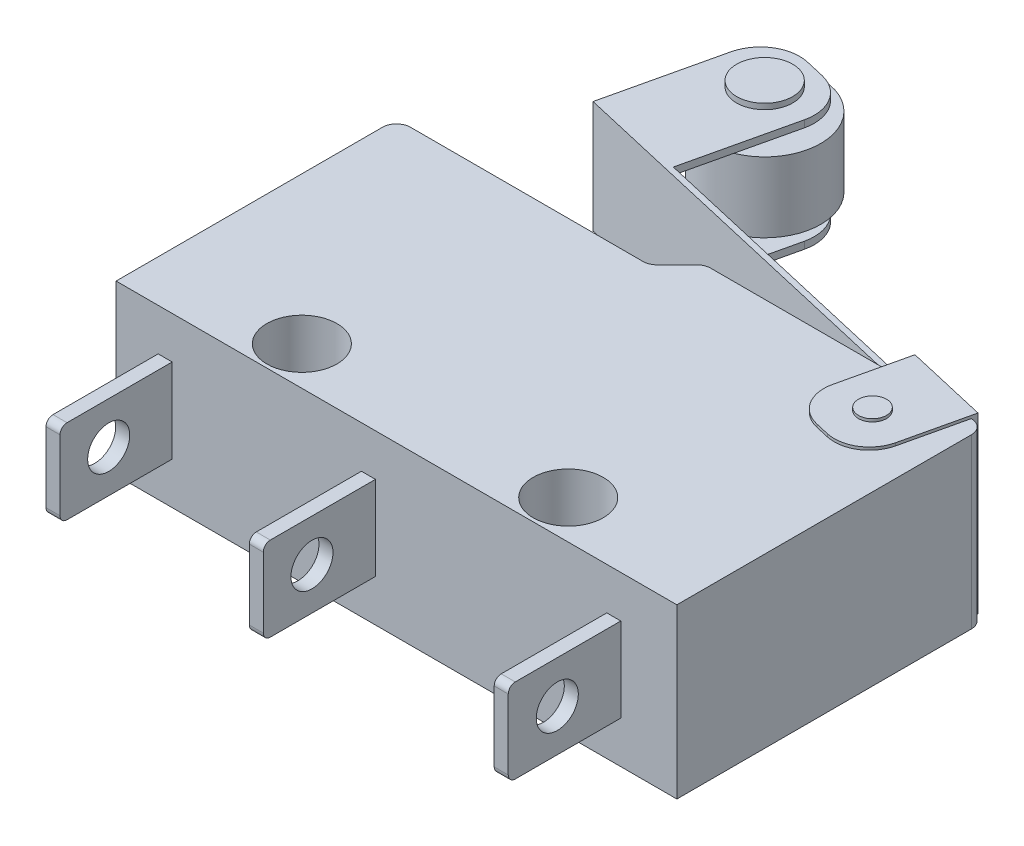
from build123d import *

# Parameters (mm, degrees)
Y_KSEKLIK_EKSTR_ZYON1_DEPTH       = 3
Y_KSEKLIK_EKSTR_ZYON1_DEPTH_BACK  = 3
IZIM1_R                           = 1.25
IZIM2_W                           = 2
IZIM2_H                           = 2
Y_KSEKLIK_EKSTR_ZYON2_DEPTH       = 1.5
Y_KSEKLIK_EKSTR_ZYON6_DEPTH       = 3.1
Y_KSEKLIK_EKSTR_ZYON6_DEPTH_BACK  = 3.1
KES_EKSTR_ZYON1_DEPTH             = 6
KES_EKSTR_ZYON1_DEPTH_BACK        = 0.5
IZIM5_W                           = 5
IZIM5_H                           = 3.50112481
KES_EKSTR_ZYON2_DEPTH             = 5.25
Y_KSEKLIK_EKSTR_ZYON7_DEPTH       = 1.25
Y_KSEKLIK_EKSTR_ZYON7_DEPTH_BACK  = 1.25
IZIM6_R                           = 2
Y_KSEKLIK_EKSTR_ZYON8_DEPTH       = 2.2
Y_KSEKLIK_EKSTR_ZYON8_DEPTH_BACK  = 2.2
IZIM7_R                           = 1
Y_KSEKLIK_EKSTR_ZYON9_DEPTH       = 0.25
Y_KSEKLIK_EKSTR_ZYON9_DEPTH_BACK  = 0.25
Y_KSEKLIK_EKSTR_ZYON10_DEPTH      = 0.25
Y_KSEKLIK_EKSTR_ZYON10_DEPTH_BACK = 0.25
Y_KSEKLIK_EKSTR_ZYON11_DEPTH      = 0.25
Y_KSEKLIK_EKSTR_ZYON11_DEPTH_BACK = 0.25
KES_EKSTR_ZYON3_REACH             = 25.675
IZIM11_R                          = 0.75
Y_KSEKLIK_EKSTR_ZYON13_DEPTH      = 3.2
Y_KSEKLIK_EKSTR_ZYON13_DEPTH_BACK = 3.2
IZIM13_R                          = 0.5


with BuildPart() as part:
    # Çizim1 → Yükseklik-Ekstrüzyon1 (new, two sides: drawn at the far end of the back side and taken through both)
    with BuildSketch(Plane(origin=(0, 0, 0), x_dir=(1, 0, 0), z_dir=(0, 1, 0)).offset(-Y_KSEKLIK_EKSTR_ZYON1_DEPTH_BACK)):
        with BuildLine():
            Line((0.207106781, 5.5), (9.5, 5.5))
            ThreePointArc((9.5, 5.5), (9.853553391, 5.353553391), (10, 5))
            Line((10, 5), (10, -5.5))
            Line((10, -5.5), (-10, -5.5))
            Line((-10, -5.5), (-10, 4))
            ThreePointArc((-10, 4), (-9.853553391, 4.353553391), (-9.5, 4.5))
            Line((-9.5, 4.5), (-1.207106781, 4.5))
            ThreePointArc((-1.207106781, 4.5), (-1.015765065, 4.538060234), (-0.853553391, 4.646446609))
            Line((-0.853553391, 4.646446609), (-0.146446609, 5.353553391))
            ThreePointArc((-0.146446609, 5.353553391), (0.015765065, 5.461939766), (0.207106781, 5.5))
        make_face()
        with Locations(Location((-4.75, -4.125, 0), (0, 0, 270))):
            Circle(IZIM1_R, mode=Mode.SUBTRACT)
        with Locations(Location((4.75, -4.125, 0), (0, 0, 90))):
            Circle(IZIM1_R, mode=Mode.SUBTRACT)
    extrude(amount=Y_KSEKLIK_EKSTR_ZYON1_DEPTH + Y_KSEKLIK_EKSTR_ZYON1_DEPTH_BACK)

    # Çizim2 → Yükseklik-Ekstrüzyon2 (add)
    with BuildSketch(Plane(origin=(0, 0, -5.5), x_dir=(-1, 0, 0), z_dir=(0, 0, -1))):
        with Locations((-1.853553391, 0)):
            Rectangle(IZIM2_W, IZIM2_H)
    extrude(amount=Y_KSEKLIK_EKSTR_ZYON2_DEPTH)

    # Çizim3 → Yükseklik-Ekstrüzyon6 (add, two sides: drawn at the far end of the back side and taken through both)
    with BuildSketch(Plane(origin=(0, 0, 0), x_dir=(1, 0, 0), z_dir=(0, 1, 0)).offset(-Y_KSEKLIK_EKSTR_ZYON6_DEPTH_BACK)):
        with BuildLine():
            Line((9.5, 5.5), (8.993860128, 3.307667354))
            ThreePointArc((8.993860128, 3.307667354), (8.438296627, 2.528796052), (7.494708729, 2.370893591))
            Line((7.494708729, 2.370893591), (7.007523696, 2.483369118))
            ThreePointArc((7.007523696, 2.483369118), (6.228652394, 3.038932619), (6.070749933, 3.982520517))
            Line((6.070749933, 3.982520517), (6.576889806, 6.174853163))
            Line((6.576889806, 6.174853163), (-8.038661166, 9.549118978))
            Line((-8.038661166, 9.549118978), (-7.116361843, 13.544036244))
            ThreePointArc((-7.116361843, 13.544036244), (-6.494130723, 14.416372102), (-5.437312277, 14.593222858))
            Line((-5.437312277, 14.593222858), (-4.755253231, 14.43575712))
            ThreePointArc((-4.755253231, 14.43575712), (-3.882917373, 13.813526), (-3.706066617, 12.756707554))
            Line((-3.706066617, 12.756707554), (-4.583375729, 8.956664301))
            Line((-4.583375729, 8.956664301), (9.544990211, 5.694874013))
            Line((9.544990211, 5.694874013), (9.5, 5.5))
        make_face()
    extrude(amount=Y_KSEKLIK_EKSTR_ZYON6_DEPTH + Y_KSEKLIK_EKSTR_ZYON6_DEPTH_BACK)

    # Çizim4 → Kes-Ekstrüzyon1 (cut, two sides: drawn at the far end of the back side and taken through both)
    with BuildSketch(Plane(origin=(1.731239145, 0, -7.498820588), x_dir=(-0.9743700647852337, 0, -0.2249510543438719), z_dir=(0.22495105434387186, 0, -0.9743700647852336)).offset(-KES_EKSTR_ZYON1_DEPTH_BACK)):
        Polygon((-5.019284817, 2.500562405), (-4.519284817, 2.000562405), (10.019957698, 2.000562405), (10.019957698, 3.1), (-5.019284817, 3.1), align=None)
        Polygon((-4.519284817, -2.000562405), (10.019957698, -2.000562405), (10.019957698, -3.1), (-5.019284817, -3.1), (-5.019284817, -2.500562405), align=None)
    extrude(amount=KES_EKSTR_ZYON1_DEPTH + KES_EKSTR_ZYON1_DEPTH_BACK, mode=Mode.SUBTRACT)

    # Çizim5 → Kes-Ekstrüzyon2 (cut)
    with BuildSketch(Plane(origin=(2.923479733, 0, -12.662981931), x_dir=(-0.9743700647852332, 0, -0.2249510543438736), z_dir=(0.2249510543438736, 0, -0.9743700647852332))):
        with Locations((8.230715183, 0)):
            Rectangle(IZIM5_W, IZIM5_H)
    extrude(amount=-KES_EKSTR_ZYON2_DEPTH, mode=Mode.SUBTRACT)



with BuildPart() as body_2:
    # Çizim6 → Yükseklik-Ekstrüzyon7 (new, two sides: drawn at the far end of the back side and taken through both)
    with BuildSketch(Plane(origin=(0, 0.000562405, 0), x_dir=(1, 0, 0), z_dir=(0, 1, 0)).offset(-Y_KSEKLIK_EKSTR_ZYON7_DEPTH_BACK)):
        with Locations(Location((-5.431324974, 13.063262696, 0), (0, 0, 270))):
            Circle(IZIM6_R)
    extrude(amount=Y_KSEKLIK_EKSTR_ZYON7_DEPTH + Y_KSEKLIK_EKSTR_ZYON7_DEPTH_BACK)


with BuildPart() as part_1:
    add(part.part)

    add(body_2.part)  # Yükseklik-Ekstrüzyon8 merges body 2
    # Çizim7 → Yükseklik-Ekstrüzyon8 (add, two sides: drawn at the far end of the back side and taken through both)
    with BuildSketch(Plane(origin=(0, 0.000562405, 0), x_dir=(1, 0, 0), z_dir=(0, 1, 0)).offset(-Y_KSEKLIK_EKSTR_ZYON8_DEPTH_BACK)):
        with Locations(Location((-5.431324974, 13.063262696, 0), (0, 0, 270))):
            Circle(IZIM7_R)
    extrude(amount=Y_KSEKLIK_EKSTR_ZYON8_DEPTH + Y_KSEKLIK_EKSTR_ZYON8_DEPTH_BACK)

    # Çizim8 → Yükseklik-Ekstrüzyon9 (add, two sides: drawn at the far end of the back side and taken through both)
    with BuildSketch(Plane.ZY.offset(8.25).offset(-Y_KSEKLIK_EKSTR_ZYON9_DEPTH_BACK)):
        with BuildLine():
            Line((5.5, 1.5), (5.5, -1.5))
            Line((5.5, -1.5), (9.25, -1.5))
            ThreePointArc((9.25, -1.5), (9.426776695, -1.426776695), (9.5, -1.25))
            Line((9.5, -1.25), (9.5, 1.25))
            ThreePointArc((9.5, 1.25), (9.426776695, 1.426776695), (9.25, 1.5))
            Line((9.25, 1.5), (5.5, 1.5))
        make_face()
    extrude(amount=Y_KSEKLIK_EKSTR_ZYON9_DEPTH + Y_KSEKLIK_EKSTR_ZYON9_DEPTH_BACK)

    # Çizim9 → Yükseklik-Ekstrüzyon10 (add, two sides: drawn at the far end of the back side and taken through both)
    with BuildSketch(Plane(origin=(7.75, 0, 0), x_dir=(0, 0, -1), z_dir=(1, 0, 0)).offset(-Y_KSEKLIK_EKSTR_ZYON10_DEPTH_BACK)):
        with BuildLine():
            Line((-5.5, 1.5), (-9.264217475, 1.5))
            ThreePointArc((-9.264217475, 1.5), (-9.44099417, 1.426776695), (-9.514217475, 1.25))
            Line((-9.514217475, 1.25), (-9.514217475, -1.25))
            ThreePointArc((-9.514217475, -1.25), (-9.44099417, -1.426776695), (-9.264217475, -1.5))
            Line((-9.264217475, -1.5), (-5.5, -1.5))
            Line((-5.5, -1.5), (-5.5, 1.5))
        make_face()
    extrude(amount=Y_KSEKLIK_EKSTR_ZYON10_DEPTH + Y_KSEKLIK_EKSTR_ZYON10_DEPTH_BACK)

    # Çizim10 → Yükseklik-Ekstrüzyon11 (add, two sides: drawn at the far end of the back side and taken through both)
    with BuildSketch(Plane(origin=(-1, 0, 0), x_dir=(0, 0, -1), z_dir=(1, 0, 0)).offset(-Y_KSEKLIK_EKSTR_ZYON11_DEPTH_BACK)):
        with BuildLine():
            Line((-5.5, 1.5), (-9.25, 1.5))
            ThreePointArc((-9.25, 1.5), (-9.426776695, 1.426776695), (-9.5, 1.25))
            Line((-9.5, 1.25), (-9.5, -1.25))
            ThreePointArc((-9.5, -1.25), (-9.426776695, -1.426776695), (-9.25, -1.5))
            Line((-9.25, -1.5), (-5.5, -1.5))
            Line((-5.5, -1.5), (-5.5, 1.5))
        make_face()
    extrude(amount=Y_KSEKLIK_EKSTR_ZYON11_DEPTH + Y_KSEKLIK_EKSTR_ZYON11_DEPTH_BACK)

    # Kes-Ekstrüzyon3: up to this face of the body (flat: up to its plane)
    kes_ekstr_zyon3_end = Plane(part_1.part.faces().sort_by_distance((-10, 0, 0.75))[0])
    # Çizim11 → Kes-Ekstrüzyon3 (cut, up to the picked face)
    with BuildSketch(Plane(origin=(8, 0, 0), x_dir=(0, 0, -1), z_dir=(1, 0, 0)), mode=Mode.PRIVATE) as kes_ekstr_zyon3_sk1:
        with Locations(Location((-7.764217475, 0, 0), (0, 0, 180))):
            Circle(IZIM11_R)
    kes_ekstr_zyon3_tool1 = split(extrude(kes_ekstr_zyon3_sk1.sketch, amount=-KES_EKSTR_ZYON3_REACH, mode=Mode.PRIVATE), bisect_by=kes_ekstr_zyon3_end, keep=Keep.BOTH, mode=Mode.PRIVATE)
    add(kes_ekstr_zyon3_tool1.solids().sort_by(Axis((8, 0, 7.764217), (-1, 0, 0)))[0], mode=Mode.SUBTRACT)

    # Çizim13 → Yükseklik-Ekstrüzyon13 (add, two sides: drawn at the far end of the back side and taken through both)
    with BuildSketch(Plane(origin=(0, 0, 0), x_dir=(1, 0, 0), z_dir=(0, 1, 0)).offset(-Y_KSEKLIK_EKSTR_ZYON13_DEPTH_BACK)):
        with Locations(Location((7.588542794, 3.888686452, 0), (0, 0, 270))):
            Circle(IZIM13_R)
    extrude(amount=Y_KSEKLIK_EKSTR_ZYON13_DEPTH + Y_KSEKLIK_EKSTR_ZYON13_DEPTH_BACK)


solid = part_1.part
